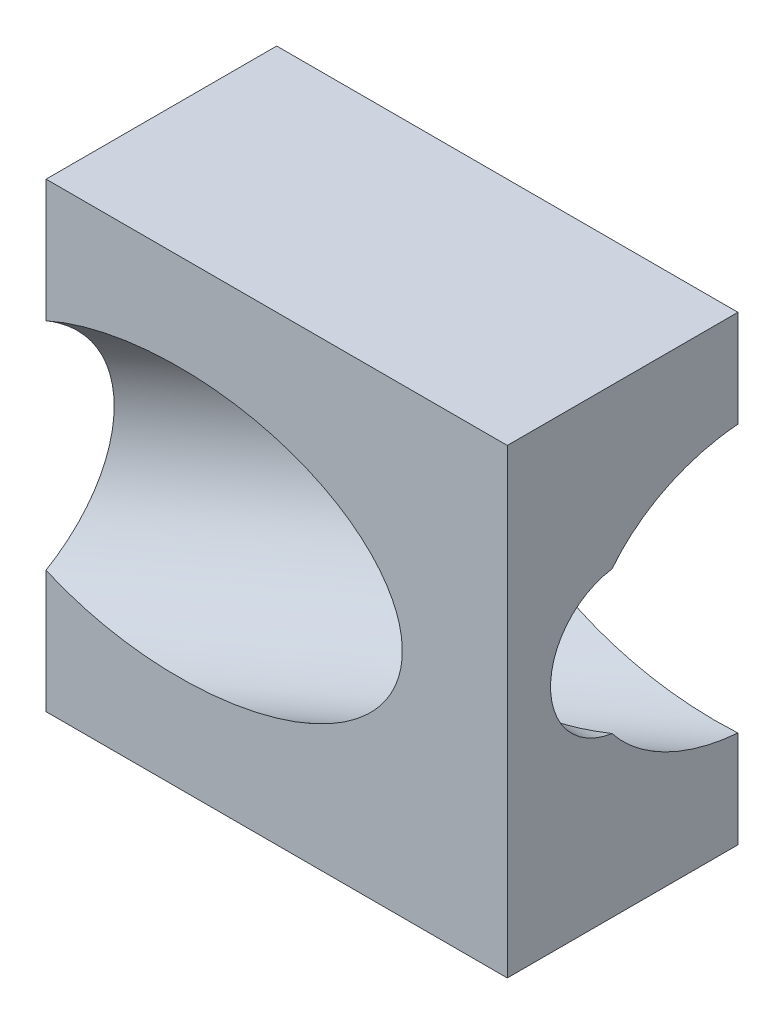
from build123d import *

# Parameters (mm, degrees)
SKETCH1_W           = 50.8
SKETCH1_H           = 50.8
BOSS_EXTRUDE1_DEPTH = 25.4
SKETCH2_R           = 7.9375
CUT_EXTRUDE1_DEPTH  = 25.4
SKETCH4_R           = 14.80168028
CUT_EXTRUDE2_DEPTH  = 113.055003212


with BuildPart() as part:
    # Sketch1 → Boss-Extrude1 (new body)
    with BuildSketch(Plane.XY):
        with Locations((25.4, 25.4)):
            Rectangle(SKETCH1_W, SKETCH1_H)
    extrude(amount=BOSS_EXTRUDE1_DEPTH)

    # Sketch2 → Cut-Extrude1 (cut)
    with BuildSketch(Plane(origin=(50.8, 0, 0), x_dir=(0, 0, -1), z_dir=(1, 0, 0))):
        with Locations((-12.7, 25.4)):
            Circle(SKETCH2_R)
    extrude(amount=-CUT_EXTRUDE1_DEPTH, mode=Mode.SUBTRACT)

    # Sketch4 → Cut-Extrude2 (cut, through all)
    with BuildSketch(Plane(origin=(-43.536509722, 0, 32.807113228), x_dir=(0, 1, 0), z_dir=(-0.7986355100472856, 0, 0.6018150231520579))):
        with Locations(Location((25.4, -29.09758227, 0), (0, 0, 237.964118951))):
            Circle(SKETCH4_R)
    extrude(amount=-CUT_EXTRUDE2_DEPTH, mode=Mode.SUBTRACT)


solid = part.part
